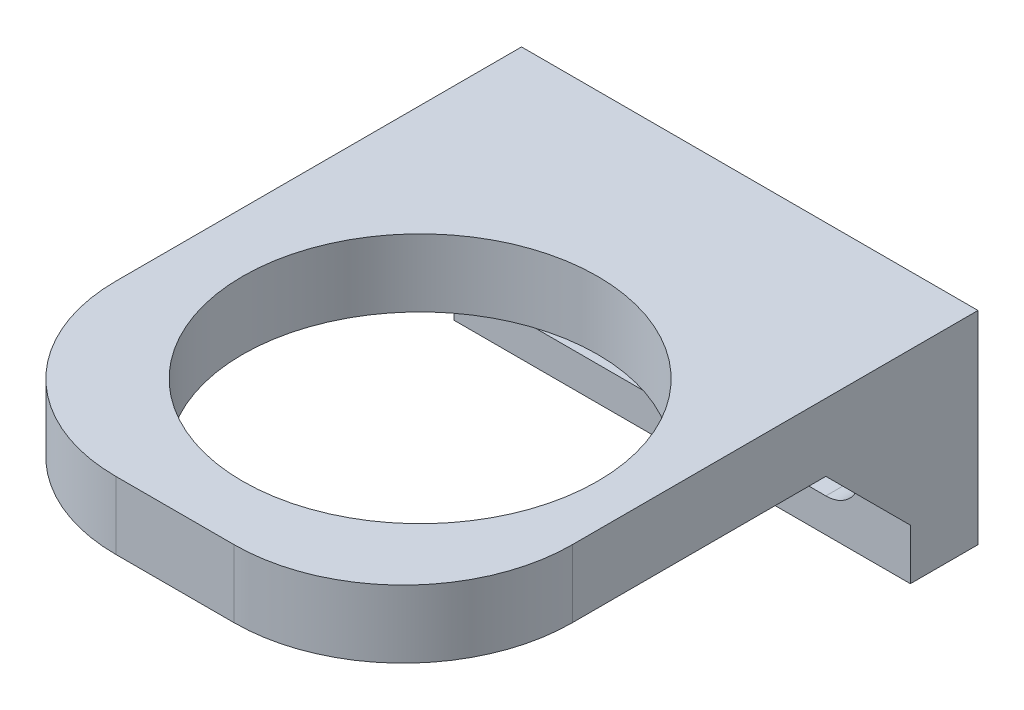
from build123d import *

# Parameters (mm, degrees)
ESQUISSE1_W             = 27
ESQUISSE1_H             = 34
ESQUISSE1_R             = 10.5
BOSS_EXTRU_1_DEPTH      = 4
ESQUISSE2_W             = 27
ESQUISSE2_H             = 4
BOSS_EXTRU_2_DEPTH      = 8
BOSS_EXTRU_3_DEPTH      = 2
BOSS_EXTRU_4_DEPTH      = 2
CONG_1_R                = 10
ENL_V_MAT_EXTRU_1_DEPTH = 35.058772732


with BuildPart() as part:
    # Esquisse1 → Boss.-Extru.1 (new body)
    with BuildSketch(Plane(origin=(0, 0, 0), x_dir=(1, 0, 0), z_dir=(0, 1, 0))):
        with Locations((-0.5, 3)):
            Rectangle(ESQUISSE1_W, ESQUISSE1_H)
        with Locations(Location((0, 0, 0), (0, 0, 270))):
            Circle(ESQUISSE1_R, mode=Mode.SUBTRACT)
    extrude(amount=BOSS_EXTRU_1_DEPTH)

    # Esquisse2 → Boss.-Extru.2 (add)
    with BuildSketch(Plane.XZ):
        with Locations((-0.5, -18)):
            Rectangle(ESQUISSE2_W, ESQUISSE2_H)
    extrude(amount=BOSS_EXTRU_2_DEPTH)

    # Esquisse5 → Boss.-Extru.3 (add)
    with BuildSketch(Plane.ZY.offset(14)):
        Polygon((-16, 0), (-16, -5), (-11, 0), align=None)
    extrude(amount=-BOSS_EXTRU_3_DEPTH)

    # Esquisse6 → Boss.-Extru.4 (add)
    with BuildSketch(Plane(origin=(13, 0, 0), x_dir=(0, 0, -1), z_dir=(1, 0, 0))):
        Polygon((16, 0), (11, 0), (16, -5), align=None)
    extrude(amount=-BOSS_EXTRU_4_DEPTH)

    # Congé1
    cong_1_edges = [part.edges().sort_by_distance(p)[0] for p in [
        (-14, 2, 14),
        (13, 2, 14),
    ]]
    fillet(cong_1_edges, radius=CONG_1_R)

    # Esquisse7 → Enlèv. mat.-Extru.1 (cut, through all)
    with BuildSketch(Plane.XY.offset(-16)):
        with BuildLine():
            Line((-9, -2), (8, -2))
            ThreePointArc((8, -2), (10, -4), (8, -6))
            Line((8, -6), (-9, -6))
            ThreePointArc((-9, -6), (-11, -4), (-9, -2))
        make_face()
    extrude(amount=-ENL_V_MAT_EXTRU_1_DEPTH, mode=Mode.SUBTRACT)


solid = part.part
